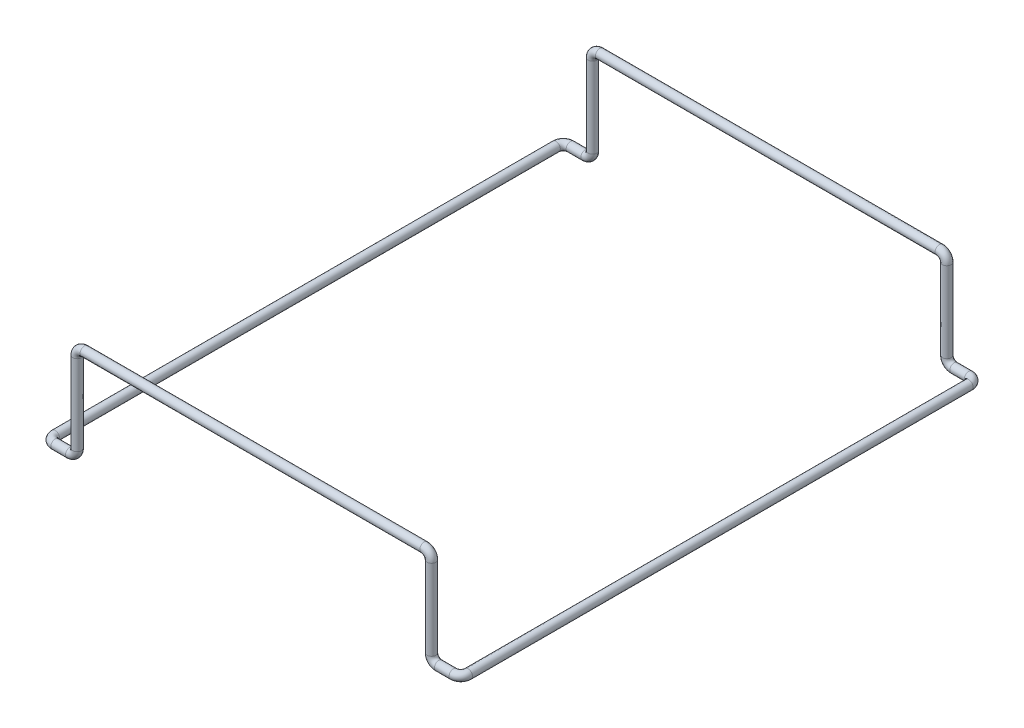
from build123d import *

# Parameters (mm, degrees)
SKETCH1_R = 3


with BuildPart() as part:
    # Sweep1: sweep along a curve in space
    with BuildLine() as sweep1_path:
        Line((0, 0, 5), (0, 0, 347))
        ThreePointArc((5, 0, 352), (1.464466094, 0, 350.535533906), (0, 0, 347))
        Line((5, 0, 352), (15, 0, 352))
        ThreePointArc((15, 0, 352), (18.535533906, 1.464466094, 352), (20, 5, 352))
        Line((20, 5, 352), (20, 60, 352))
        ThreePointArc((25, 65, 352), (21.464466094, 63.535533906, 352), (20, 60, 352))
        Line((25, 65, 352), (257, 65, 352))
        ThreePointArc((262, 60, 352), (260.535533906, 63.535533906, 352), (257, 65, 352))
        Line((262, 60, 352), (262, 5, 352))
        ThreePointArc((267, 0, 352), (263.464466094, 1.464466094, 352), (262, 5, 352))
        Line((267, 0, 352), (277, 0, 352))
        ThreePointArc((282, 0, 347), (280.535533906, 0, 350.535533906), (277, 0, 352))
        Line((282, 0, 347), (282, 0, 5))
        ThreePointArc((282, 0, 5), (280.535533906, 0, 1.464466094), (277, 0, 0))
        Line((267, 0, 0), (277, 0, 0))
        ThreePointArc((267, 0, 0), (263.464466094, 1.464466094, 0), (262, 5, 0))
        Line((262, 60, 0), (262, 5, 0))
        ThreePointArc((262, 60, 0), (260.535533906, 63.535533906, 0), (257, 65, 0))
        Line((25, 65, 0), (257, 65, 0))
        ThreePointArc((20, 60, 0), (21.464466094, 63.535533906, 0), (25, 65, 0))
        Line((20, 5, 0), (20, 60, 0))
        ThreePointArc((15, 0, 0), (18.535533906, 1.464466094, 0), (20, 5, 0))
        Line((5, 0, 0), (15, 0, 0))
        ThreePointArc((5, 0, 0), (1.464466094, 0, 1.464466094), (0, 0, 5))
    # Sketch1 → Sweep1 (sweep)
    with BuildSketch(Plane(origin=(282, 0, 5), x_dir=(-1, 0, 0), z_dir=(0, 0, -1))):
        Circle(SKETCH1_R)
    sweep(path=sweep1_path.line)


solid = part.part
